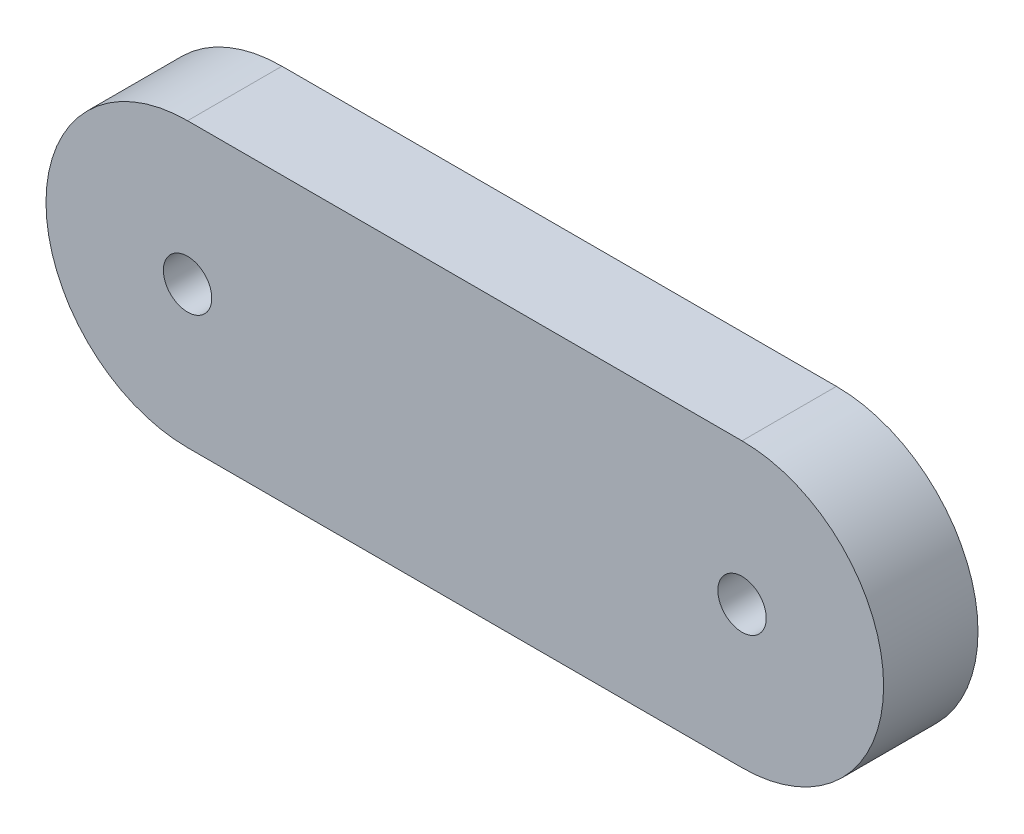
from build123d import *

# Parameters (mm, degrees)
BOSS_EXTRUDE1_DEPTH            = 2
TAP_DRILL_FOR_M2_5X0_45_TAP1_D = 2.05


with BuildPart() as part:
    # Sketch1 → Boss-Extrude1 (new, symmetric)
    with BuildSketch(Plane.XY):
        with BuildLine():
            Line((-11.817810242, 6.443484678), (11.682189758, 6.443484678))
            ThreePointArc((11.682189758, 6.443484678), (17.682189758, 0.443484678), (11.682189758, -5.556515322))
            Line((11.682189758, -5.556515322), (-11.817810242, -5.556515322))
            ThreePointArc((-11.817810242, -5.556515322), (-17.817810242, 0.443484678), (-11.817810242, 6.443484678))
        make_face()
    extrude(amount=BOSS_EXTRUDE1_DEPTH, both=True)

    # Tap Drill for M2.5x0.45 Tap1 (through all)
    with Locations(Plane(origin=(-11.817810242, 0.443484678, 2), x_dir=(1, 0, 0), z_dir=(0, 0, 1))):
        with Locations((0, 0), (23.5, 0)):
            Hole(TAP_DRILL_FOR_M2_5X0_45_TAP1_D / 2)


solid = part.part
